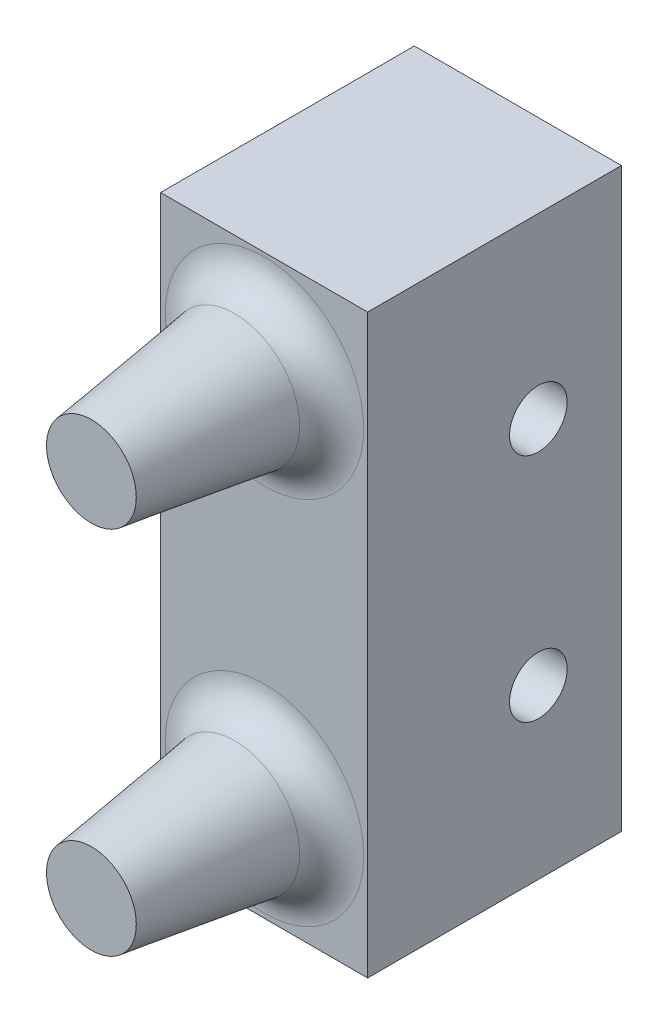
from build123d import *

# Parameters (mm, degrees)
BOSS_EXTRUDE1_DEPTH           = 22
SKETCH3_R                     = 6
BOSS_EXTRUDE3_DEPTH           = 15
BOSS_EXTRUDE3_DRAFT           = 8
BOSS_EXTRUDE3_PROFILE_2_DEPTH = 15
BOSS_EXTRUDE3_PROFILE_2_DRAFT = 8
FILLET2_R                     = 3
SKETCH4_R                     = 2.500012638
CUT_EXTRUDE1_DEPTH            = 50
SKETCH5_R                     = 2.500012638
CUT_EXTRUDE2_DEPTH            = 50


with BuildPart() as part:
    # Sketch2 → Boss-Extrude1 (new body)
    with BuildSketch(Plane.XY):
        Polygon((697.707943159, -649.017765949), (697.707943159, -690.080887605), (715.655949844, -690.080887605), (715.655949844, -640.080811229), (697.707943159, -640.080811229), align=None)
    extrude(amount=-BOSS_EXTRUDE1_DEPTH)


with BuildPart() as boss_extrude3_tool:
    # Sketch3 → Boss-Extrude3 (with draft: the straight prism first)
    with BuildSketch(Plane.XY):
        with Locations((706.707943159, -649.017765949)):
            Circle(SKETCH3_R)
    extrude(amount=BOSS_EXTRUDE3_DEPTH)
    # Boss-Extrude3: the draft: its side faces are tilted about the plane it starts from
    boss_extrude3_sides = [boss_extrude3_tool.faces().sort_by_distance(p)[0] for p in [
        (700.707943159, -649.017765949, 7.5),
    ]]
    draft(boss_extrude3_sides, Plane.XY, BOSS_EXTRUDE3_DRAFT)


with BuildPart() as part_1:
    add(part.part)

    # Boss-Extrude3: add boss_extrude3_tool
    add(boss_extrude3_tool.part)


with BuildPart() as boss_extrude3_profile_2_tool:
    # Sketch3 → Boss-Extrude3 profile 2 (with draft: the straight prism first)
    with BuildSketch(Plane.XY):
        with Locations((706.707943159, -681.085054274)):
            Circle(SKETCH3_R)
    extrude(amount=BOSS_EXTRUDE3_PROFILE_2_DEPTH)
    # Boss-Extrude3 profile 2: the draft: its side faces are tilted about the plane it starts from
    boss_extrude3_profile_2_sides = [boss_extrude3_profile_2_tool.faces().sort_by_distance(p)[0] for p in [
        (700.707943159, -681.085054274, 7.5),
    ]]
    draft(boss_extrude3_profile_2_sides, Plane.XY, BOSS_EXTRUDE3_PROFILE_2_DRAFT)


with BuildPart() as part_2:
    add(part_1.part)

    # Boss-Extrude3 profile 2: add boss_extrude3_profile_2_tool
    add(boss_extrude3_profile_2_tool.part)

    # Fillet2
    fillet2_edges = [part_2.edges().sort_by_distance(p)[0] for p in [
        (700.707943159, -649.017765949, 0),
        (700.707943159, -681.085054274, 0),
    ]]
    fillet(fillet2_edges, radius=FILLET2_R)

    # Sketch4 → Cut-Extrude1 (cut)
    with BuildSketch(Plane(origin=(715.655949844, 0, 0), x_dir=(0, 0, -1), z_dir=(1, 0, 0))):
        with Locations((14.80020958, -655.486173041)):
            Circle(SKETCH4_R)
    extrude(amount=-CUT_EXTRUDE1_DEPTH, mode=Mode.SUBTRACT)

    # Sketch5 → Cut-Extrude2 (cut)
    with BuildSketch(Plane(origin=(715.655949844, 0, 0), x_dir=(0, 0, -1), z_dir=(1, 0, 0))):
        with Locations((14.80020958, -675.510263036)):
            Circle(SKETCH5_R)
    extrude(amount=-CUT_EXTRUDE2_DEPTH, mode=Mode.SUBTRACT)


solid = part_2.part
